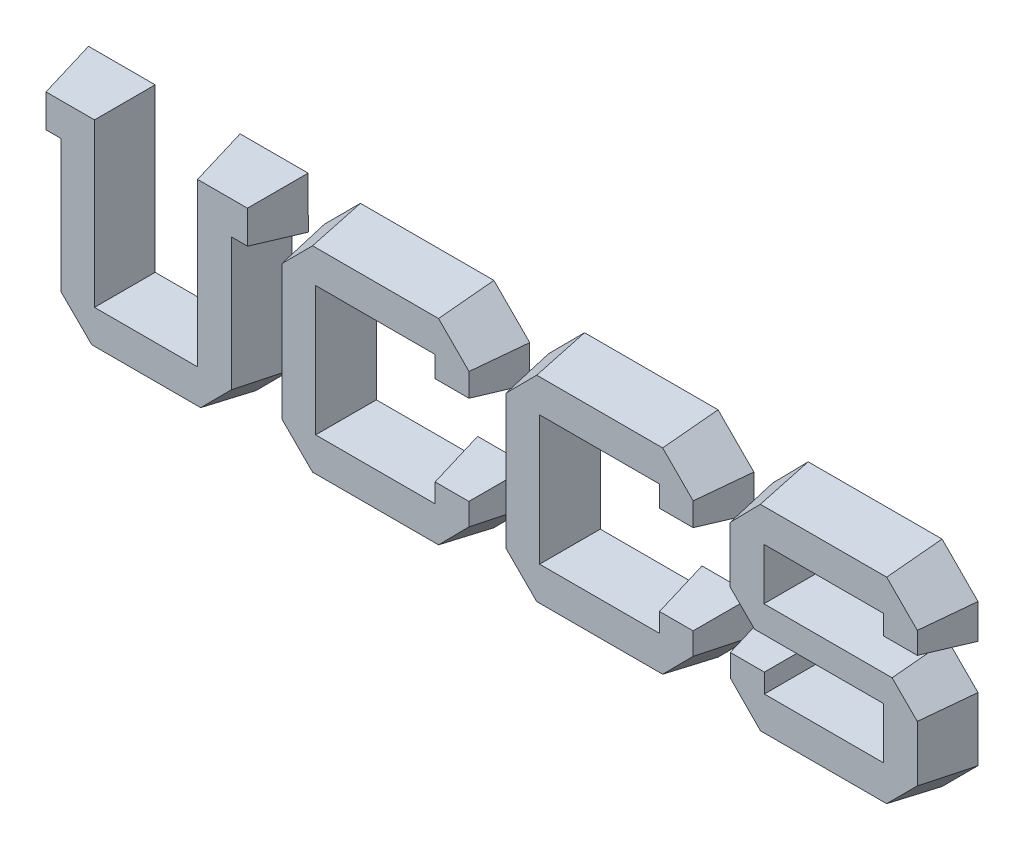
from build123d import *

# Parameters (mm, degrees)
BOSS_EXTRUDE1_DEPTH           = 4
BOSS_EXTRUDE1_DRAFT           = 10
BOSS_EXTRUDE1_PROFILE_2_DEPTH = 4
BOSS_EXTRUDE1_PROFILE_2_DRAFT = 10
BOSS_EXTRUDE1_PROFILE_3_DEPTH = 4
BOSS_EXTRUDE1_PROFILE_3_DRAFT = 10
BOSS_EXTRUDE1_PROFILE_4_DEPTH = 4
BOSS_EXTRUDE1_PROFILE_4_DRAFT = 10
SKETCH5_R                     = 1.127
CUT_EXTRUDE1_DEPTH            = 2.01


with BuildPart() as part:
    # Sketch2 → Boss-Extrude1 (with draft: the straight prism first)
    with BuildSketch(Plane.XY):
        Polygon((67.842511, 25.0268486), (57.459499, 25.020143), (54.710838, 22.2244412), (54.710838, 17.2983906), (57.0159388, 15.0000208), (66.5925262, 15.0067264), (66.5925262, 12.4395484), (58.7699612, 12.4395484), (58.7699612, 13.9113006), (54.717569, 13.9113006), (54.717569, 11.2029748), (57.4662046, 8.4072984), (67.8358054, 8.4072984), (70.6247762, 11.2029748), (70.6247762, 16.1155888), (68.259198, 18.4811924), (58.736357, 18.4811924), (58.736357, 21.061807), (66.5857952, 21.061807), (66.5857952, 19.5497196), (70.6247762, 19.5497196), (70.6247762, 22.2244412), align=None)
    extrude(amount=BOSS_EXTRUDE1_DEPTH)
    # Boss-Extrude1: the draft: its side faces are tilted about the plane it starts from
    boss_extrude1_sides = [part.faces().sort_by_distance(p)[0] for p in [
        (62.651005, 25.0234958, 2),
        (56.0851685, 23.6222921, 2),
        (54.710838, 19.7614159, 2),
        (55.8633884, 16.1492057, 2),
        (61.8042325, 15.0033736, 2),
        (66.5925262, 13.7231374, 2),
        (62.6812437, 12.4395484, 2),
        (58.7699612, 13.1754245, 2),
        (56.7437651, 13.9113006, 2),
        (54.717569, 12.5571377, 2),
        (56.0918868, 9.8051366, 2),
        (62.651005, 8.4072984, 2),
        (69.2302908, 9.8051366, 2),
        (70.6247762, 13.6592818, 2),
        (69.4419871, 17.2983906, 2),
        (63.4977775, 18.4811924, 2),
        (58.736357, 19.7714997, 2),
        (62.6610761, 21.061807, 2),
        (66.5857952, 20.3057633, 2),
        (68.6052857, 19.5497196, 2),
        (70.6247762, 20.8870804, 2),
        (69.2336436, 23.6256449, 2),
    ]]
    draft(boss_extrude1_sides, Plane.XY, BOSS_EXTRUDE1_DRAFT)


with BuildPart() as body_2:
    # Sketch2 → Boss-Extrude1 profile 2 (with draft: the straight prism first)
    with BuildSketch(Plane.XY):
        Polygon((50.4769882, 25.020143), (40.127555, 25.020143), (37.3453152, 22.2244412), (37.3385842, 11.2029748), (40.127555, 8.414004), (50.4769882, 8.414004), (53.2457914, 11.2097058), (53.2457914, 13.9180316), (49.233709, 13.9180316), (49.233709, 12.446254), (41.3506666, 12.446254), (41.3506666, 21.061807), (49.233709, 21.061807), (49.233709, 19.4354704), (53.2525224, 19.4354704), (53.2525224, 22.2311722), align=None)
    extrude(amount=BOSS_EXTRUDE1_PROFILE_2_DEPTH)
    # Boss-Extrude1 profile 2: the draft: its side faces are tilted about the plane it starts from
    boss_extrude1_profile_2_sides = [body_2.faces().sort_by_distance(p)[0] for p in [
        (45.3022716, 25.020143, 2),
        (38.7364351, 23.6222921, 2),
        (37.3419497, 16.713708, 2),
        (38.7330696, 9.8084894, 2),
        (45.3022716, 8.414004, 2),
        (51.8613898, 9.8118549, 2),
        (53.2457914, 12.5638687, 2),
        (51.2397502, 13.9180316, 2),
        (49.233709, 13.1821428, 2),
        (45.2921878, 12.446254, 2),
        (41.3506666, 16.7540305, 2),
        (45.2921878, 21.061807, 2),
        (49.233709, 20.2486387, 2),
        (51.2431157, 19.4354704, 2),
        (53.2525224, 20.8333213, 2),
        (51.8647553, 23.6256576, 2),
    ]]
    draft(boss_extrude1_profile_2_sides, Plane.XY, BOSS_EXTRUDE1_PROFILE_2_DRAFT)


with BuildPart() as body_3:
    # Sketch2 → Boss-Extrude1 profile 3 (with draft: the straight prism first)
    with BuildSketch(Plane.XY):
        Polygon((33.1047344, 25.020143), (22.7553012, 25.020143), (19.9663304, 22.2244412), (19.9596248, 11.2029748), (22.7553012, 8.414004), (33.1047344, 8.414004), (35.8668066, 11.2097058), (35.8668066, 13.9180316), (31.8412876, 13.9180316), (31.8412876, 12.446254), (23.9918494, 12.446254), (23.9918494, 21.061807), (31.8412876, 21.061807), (31.8412876, 19.4354704), (35.8735376, 19.4354704), (35.8802686, 22.2311722), align=None)
    extrude(amount=BOSS_EXTRUDE1_PROFILE_3_DEPTH)
    # Boss-Extrude1 profile 3: the draft: its side faces are tilted about the plane it starts from
    boss_extrude1_profile_3_sides = [body_3.faces().sort_by_distance(p)[0] for p in [
        (27.9300178, 25.020143, 2),
        (21.3608158, 23.6222921, 2),
        (19.9629776, 16.713708, 2),
        (21.357463, 9.8084894, 2),
        (27.9300178, 8.414004, 2),
        (34.4857705, 9.8118549, 2),
        (35.8668066, 12.5638687, 2),
        (33.8540471, 13.9180316, 2),
        (31.8412876, 13.1821428, 2),
        (27.9165685, 12.446254, 2),
        (23.9918494, 16.7540305, 2),
        (27.9165685, 21.061807, 2),
        (31.8412876, 20.2486387, 2),
        (33.8574126, 19.4354704, 2),
        (35.8769031, 20.8333213, 2),
        (34.4925015, 23.6256576, 2),
    ]]
    draft(boss_extrude1_profile_3_sides, Plane.XY, BOSS_EXTRUDE1_PROFILE_3_DRAFT)


with BuildPart() as body_4:
    # Sketch2 → Boss-Extrude1 profile 4 (with draft: the straight prism first)
    with BuildSketch(Plane.XY):
        Polygon((18.7028836, 25.020143), (13.4273798, 25.020143), (13.4273798, 12.4328174), (6.848094, 12.4328174), (6.848094, 25.020143), (1.6801084, 25.020143), (1.6801084, 21.061807), (2.8292806, 21.061807), (2.8292806, 11.1962692), (5.64515, 8.4072984), (14.670659, 8.4072984), (17.4596298, 11.2097058), (17.4596298, 21.061807), (18.7163456, 21.061807), align=None)
    extrude(amount=BOSS_EXTRUDE1_PROFILE_4_DEPTH)
    # Boss-Extrude1 profile 4: the draft: its side faces are tilted about the plane it starts from
    boss_extrude1_profile_4_sides = [body_4.faces().sort_by_distance(p)[0] for p in [
        (16.0651317, 25.020143, 2),
        (13.4273798, 18.7264802, 2),
        (10.1377369, 12.4328174, 2),
        (6.848094, 18.7264802, 2),
        (4.2641012, 25.020143, 2),
        (1.6801084, 23.040975, 2),
        (2.2546945, 21.061807, 2),
        (2.8292806, 16.1290381, 2),
        (4.2372153, 9.8017838, 2),
        (10.1579045, 8.4072984, 2),
        (16.0651444, 9.8085021, 2),
        (17.4596298, 16.1357564, 2),
        (18.0879877, 21.061807, 2),
        (18.7096146, 23.040975, 2),
    ]]
    draft(boss_extrude1_profile_4_sides, Plane.XY, BOSS_EXTRUDE1_PROFILE_4_DRAFT)


with BuildPart() as cut_extrude1_tool:
    # Sketch5 → Cut-Extrude1 (new body)
    with BuildSketch(Plane(origin=(0, 0, 0), x_dir=(-1, 0, 0), z_dir=(0, 0, -1))):
        with Locations((-62.893400367, 23.000943998)):
            Circle(SKETCH5_R)
        with Locations((-62.893400367, 10.395661235)):
            Circle(SKETCH5_R)
        with Locations((-45.580114566, 10.395661235)):
            Circle(SKETCH5_R)
        with Locations((-45.580114566, 23.000943998)):
            Circle(SKETCH5_R)
        with Locations((-28.180118275, 10.395661235)):
            Circle(SKETCH5_R)
        with Locations((-28.180118275, 23.000943998)):
            Circle(SKETCH5_R)
        with Locations((-15.392085226, 16.664206801)):
            Circle(SKETCH5_R)
        with Locations((-4.859282247, 16.664206801)):
            Circle(SKETCH5_R)
    extrude(amount=-CUT_EXTRUDE1_DEPTH)


with BuildPart() as part_1:
    add(part.part)

    # Cut-Extrude1: cut by cut_extrude1_tool
    add(cut_extrude1_tool.part, mode=Mode.SUBTRACT)


with BuildPart() as body_2_1:
    add(body_2.part)

    # Cut-Extrude1: cut by cut_extrude1_tool
    add(cut_extrude1_tool.part, mode=Mode.SUBTRACT)


with BuildPart() as body_3_1:
    add(body_3.part)

    # Cut-Extrude1: cut by cut_extrude1_tool
    add(cut_extrude1_tool.part, mode=Mode.SUBTRACT)


with BuildPart() as body_4_1:
    add(body_4.part)

    # Cut-Extrude1: cut by cut_extrude1_tool
    add(cut_extrude1_tool.part, mode=Mode.SUBTRACT)


solid = Compound([part_1.part, body_2_1.part, body_3_1.part, body_4_1.part])
